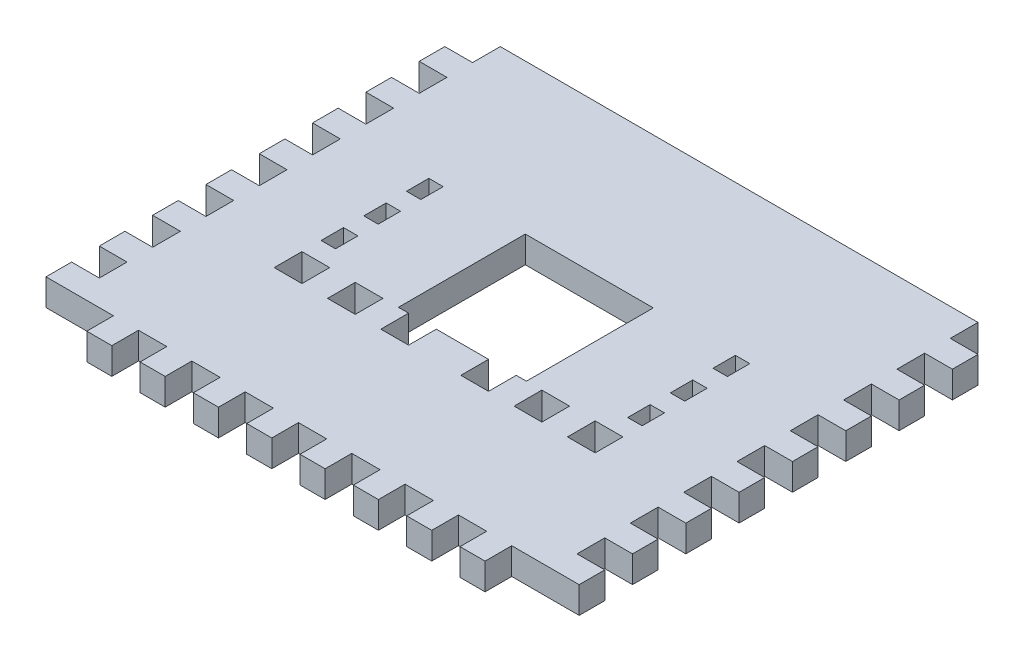
from build123d import *

# Parameters (mm, degrees)
SKETCH1_W           = 127
SKETCH1_H           = 107.95
BOSS_EXTRUDE1_DEPTH = 6.35
SKETCH2_W           = 6.604
SKETCH2_H           = 6.604
CUT_EXTRUDE1_DEPTH  = 84.58153579
SKETCH3_W           = 3.429
SKETCH3_H           = 5.334
SKETCH3_W_2         = 6.604
SKETCH3_H_2         = 6.604
CUT_EXTRUDE4_DEPTH  = 84.58153579


with BuildPart() as part:
    # Sketch1 → Boss-Extrude1 (new body)
    with BuildSketch(Plane(origin=(0, 0, 0), x_dir=(1, 0, 0), z_dir=(0, 1, 0))):
        Rectangle(SKETCH1_W, SKETCH1_H)
    extrude(amount=BOSS_EXTRUDE1_DEPTH)

    # Sketch2 → Cut-Extrude1 (cut, through all)
    with BuildSketch(Plane.XZ):
        Polygon((-34.7345, 47.625), (-41.4655, 47.625), (-41.4655, 54.229), (-47.4345, 54.229), (-47.4345, 47.625), (-56.896, 47.625), (-63.5, 47.625), (-63.5, 54.229), (-63.5, 63.03162391), (63.5, 63.03162391), (63.5, 54.229), (63.5, 47.625), (56.896, 47.625), (47.4345, 47.625), (47.4345, 54.229), (41.4655, 54.229), (41.4655, 47.625), (34.7345, 47.625), (34.7345, 54.229), (28.7655, 54.229), (28.7655, 47.625), (22.0345, 47.625), (22.0345, 54.229), (16.0655, 54.229), (16.0655, 47.625), (9.3345, 47.625), (9.3345, 54.229), (3.3655, 54.229), (3.3655, 47.625), (-3.3655, 47.625), (-3.3655, 54.229), (-9.3345, 54.229), (-9.3345, 47.625), (-16.0655, 47.625), (-16.0655, 54.229), (-22.0345, 54.229), (-22.0345, 47.625), (-28.7655, 47.625), (-28.7655, 54.229), (-34.7345, 54.229), align=None)
        with Locations((60.198, 38.227)):
            Rectangle(SKETCH2_W, SKETCH2_H)
        with Locations((60.198, 25.527)):
            Rectangle(SKETCH2_W, SKETCH2_H)
        with Locations((60.198, 12.827)):
            Rectangle(SKETCH2_W, SKETCH2_H)
        with Locations((60.198, 0.127)):
            Rectangle(SKETCH2_W, SKETCH2_H)
        with Locations((60.198, -12.573)):
            Rectangle(SKETCH2_W, SKETCH2_H)
        with Locations((60.198, -25.273)):
            Rectangle(SKETCH2_W, SKETCH2_H)
        with Locations((60.198, -37.973)):
            Rectangle(SKETCH2_W, SKETCH2_H)
        with Locations((-60.198, -37.973)):
            Rectangle(SKETCH2_W, SKETCH2_H)
        with Locations((-60.198, -25.273)):
            Rectangle(SKETCH2_W, SKETCH2_H)
        with Locations((-60.198, -12.573)):
            Rectangle(SKETCH2_W, SKETCH2_H)
        with Locations((-60.198, 0.127)):
            Rectangle(SKETCH2_W, SKETCH2_H)
        with Locations((-60.198, 12.827)):
            Rectangle(SKETCH2_W, SKETCH2_H)
        with Locations((-60.198, 25.527)):
            Rectangle(SKETCH2_W, SKETCH2_H)
        with Locations((-60.198, 38.227)):
            Rectangle(SKETCH2_W, SKETCH2_H)
        with Locations((60.198, -50.673)):
            Rectangle(SKETCH2_W, SKETCH2_H)
        with Locations((-60.198, -50.673)):
            Rectangle(SKETCH2_W, SKETCH2_H)
    extrude(amount=-CUT_EXTRUDE1_DEPTH, mode=Mode.SUBTRACT)

    # Sketch3 → Cut-Extrude4 (cut, through all)
    with BuildSketch(Plane(origin=(0, 0, 0), x_dir=(1, 0, 0), z_dir=(0, 1, 0))):
        with Locations((-36.5125, 5.461)):
            Rectangle(SKETCH3_W, SKETCH3_H)
        Polygon((15.24, 18.288), (-15.24, 18.288), (-15.24, -11.938), (-12.827, -11.938), (-12.827, -18.542), (-6.223, -18.542), (-6.223, -11.938), (6.223, -11.938), (6.223, -18.542), (12.827, -18.542), (12.827, -11.938), (15.24, -11.938), align=None)
        with Locations((-36.5125, 15.621)):
            Rectangle(SKETCH3_W, SKETCH3_H)
        with Locations((-36.5125, -4.699)):
            Rectangle(SKETCH3_W, SKETCH3_H)
        with Locations((-22.225, -15.24)):
            Rectangle(SKETCH3_W_2, SKETCH3_H_2)
        with Locations((-34.925, -15.24)):
            Rectangle(SKETCH3_W_2, SKETCH3_H_2)
        with Locations((22.225, -15.24)):
            Rectangle(SKETCH3_W_2, SKETCH3_H_2)
        with Locations((34.925, -15.24)):
            Rectangle(SKETCH3_W_2, SKETCH3_H_2)
        with Locations((36.5125, -4.699)):
            Rectangle(SKETCH3_W, SKETCH3_H)
        with Locations((36.5125, 5.461)):
            Rectangle(SKETCH3_W, SKETCH3_H)
        with Locations((36.5125, 15.621)):
            Rectangle(SKETCH3_W, SKETCH3_H)
    extrude(amount=CUT_EXTRUDE4_DEPTH, mode=Mode.SUBTRACT)


solid = part.part
